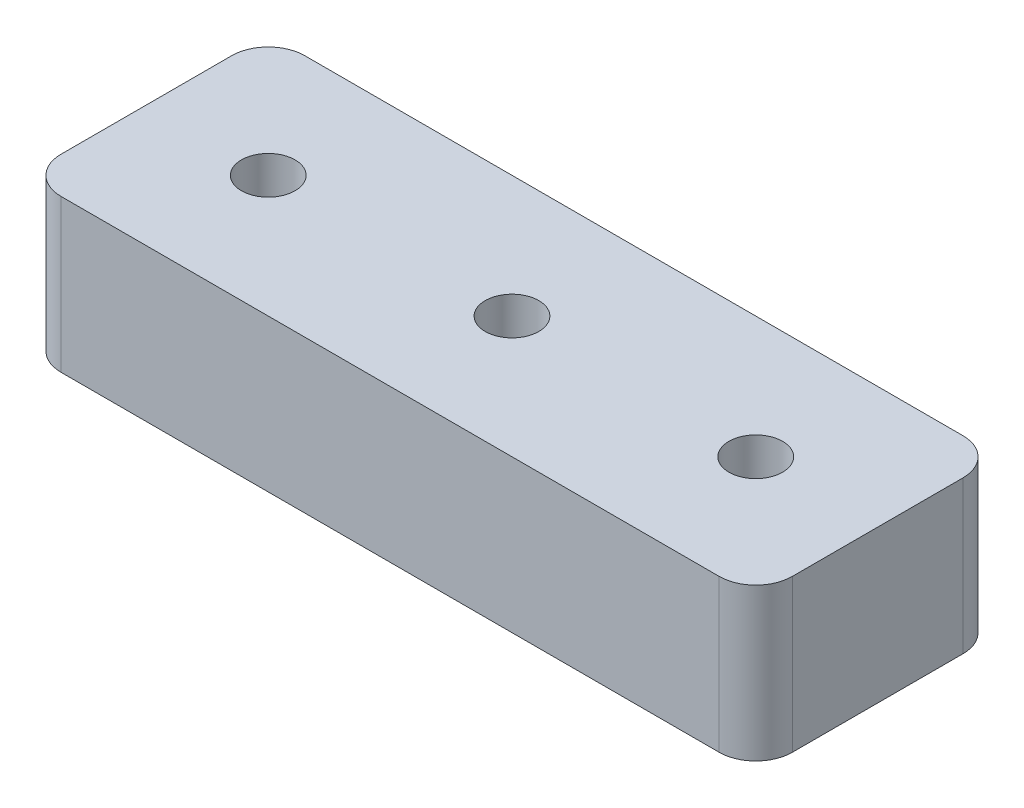
from build123d import *

# Parameters (mm, degrees)
SKETCH_1_W      = 60
SKETCH_1_H      = 20
SKETCH_1_R      = 2.2
EXTRUDE_1_DEPTH = 6.25
FILLET_1_R      = 3


with BuildPart() as part:
    # 草图1 → 凸台-拉伸1 (new, symmetric)
    with BuildSketch(Plane(origin=(0, 0, 0), x_dir=(1, 0, 0), z_dir=(0, 1, 0))):
        Rectangle(SKETCH_1_W, SKETCH_1_H)
        with Locations(Location((0, 0, 0), (0, 0, 270))):
            Circle(SKETCH_1_R, mode=Mode.SUBTRACT)
        with Locations(Location((-20, 0, 0), (0, 0, 270))):
            Circle(SKETCH_1_R, mode=Mode.SUBTRACT)
        with Locations(Location((20, 0, 0), (0, 0, 90))):
            Circle(SKETCH_1_R, mode=Mode.SUBTRACT)
    extrude(amount=EXTRUDE_1_DEPTH, both=True)

    # 圆角1
    fillet_1_edges = [part.edges().sort_by_distance(p)[0] for p in [
        (30, 0, 10),
        (-30, 0, 10),
        (-30, 0, -10),
        (30, 0, -10),
    ]]
    fillet(fillet_1_edges, radius=FILLET_1_R)


solid = part.part
